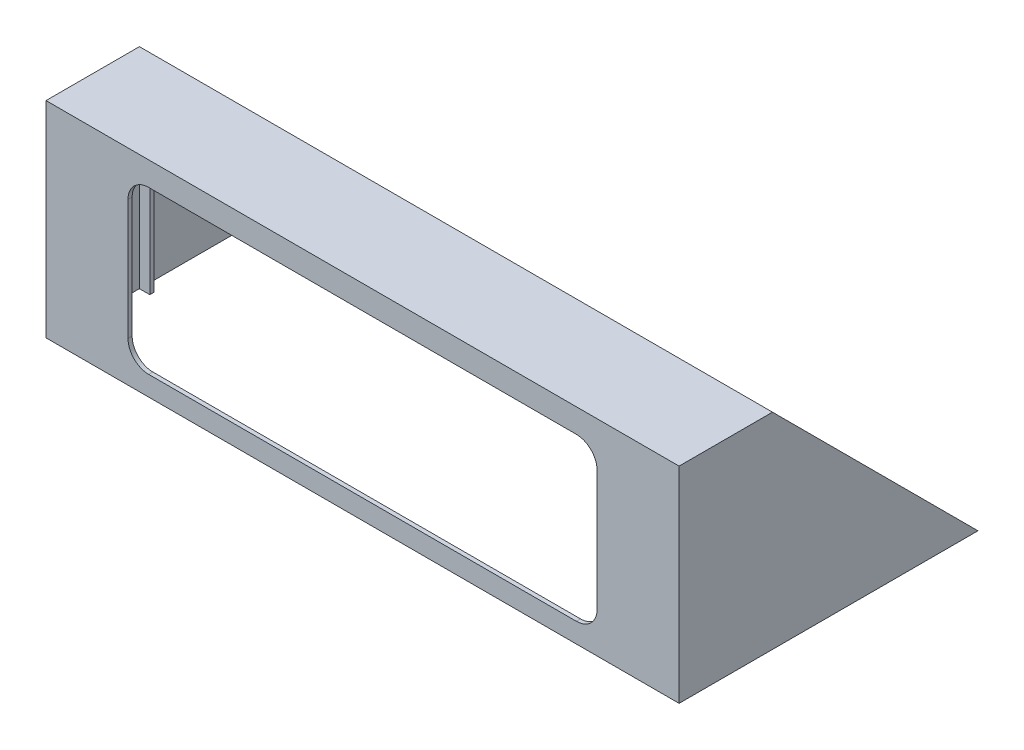
from build123d import *

# Parameters (mm, degrees)
SKETCH1_W           = 150.5
SKETCH1_H           = 48.5
BOSS_EXTRUDE1_DEPTH = 10.25
SHELL1_T            = 1
SKETCH2_W           = 145.5
SKETCH2_H           = 48.5
CUT_EXTRUDE1_DEPTH  = 1
CUT_EXTRUDE2_DEPTH  = 1
BOSS_EXTRUDE2_DEPTH = 1


with BuildPart() as part:
    # Sketch1 → Boss-Extrude1 (new, symmetric)
    with BuildSketch(Plane.XY):
        Rectangle(SKETCH1_W, SKETCH1_H)
    extrude(amount=BOSS_EXTRUDE1_DEPTH, both=True)

    # Shell1
    shell1_openings = [part.faces().sort_by_distance(p)[0] for p in [
        (0, -24.25, 0),
    ]]
    offset(amount=SHELL1_T, openings=shell1_openings, kind=Kind.INTERSECTION)

    # Sketch2 → Cut-Extrude1 (cut)
    with BuildSketch(Plane(origin=(0, 0, -11.25), x_dir=(-1, 0, 0), z_dir=(0, 0, -1))):
        Rectangle(SKETCH2_W, SKETCH2_H)
    extrude(amount=-CUT_EXTRUDE1_DEPTH, mode=Mode.SUBTRACT)

    # Sketch3 → Cut-Extrude2 (cut)
    with BuildSketch(Plane.XY.offset(11.25)):
        with BuildLine():
            Line((51.5, -19.5), (-51.5, -19.5))
            ThreePointArc((-51.5, -19.5), (-55.035533906, -18.035533906), (-56.5, -14.5))
            Line((-56.5, -14.5), (-56.5, 14.5))
            ThreePointArc((-56.5, 14.5), (-55.035533906, 18.035533906), (-51.5, 19.5))
            Line((-51.5, 19.5), (51.5, 19.5))
            ThreePointArc((51.5, 19.5), (55.035533906, 18.035533906), (56.5, 14.5))
            Line((56.5, 14.5), (56.5, -14.5))
            ThreePointArc((56.5, -14.5), (55.035533906, -18.035533906), (51.5, -19.5))
        make_face()
    extrude(amount=-CUT_EXTRUDE2_DEPTH, mode=Mode.SUBTRACT)

    # Sketch4 → Boss-Extrude2 (add)
    with BuildSketch(Plane(origin=(76.25, 0, 0), x_dir=(0, 0, -1), z_dir=(1, 0, 0))):
        Polygon((11.25, 25.25), (60.75, -24.25), (11.25, -24.25), align=None)
    boss_extrude2 = extrude(amount=-BOSS_EXTRUDE2_DEPTH)

    # Mirror1: Boss-Extrude2 across plane
    add(boss_extrude2.mirror(Plane(origin=(0, 0, 0), x_dir=(0, 0, 1), z_dir=(1, 0, 0))))


solid = part.part
